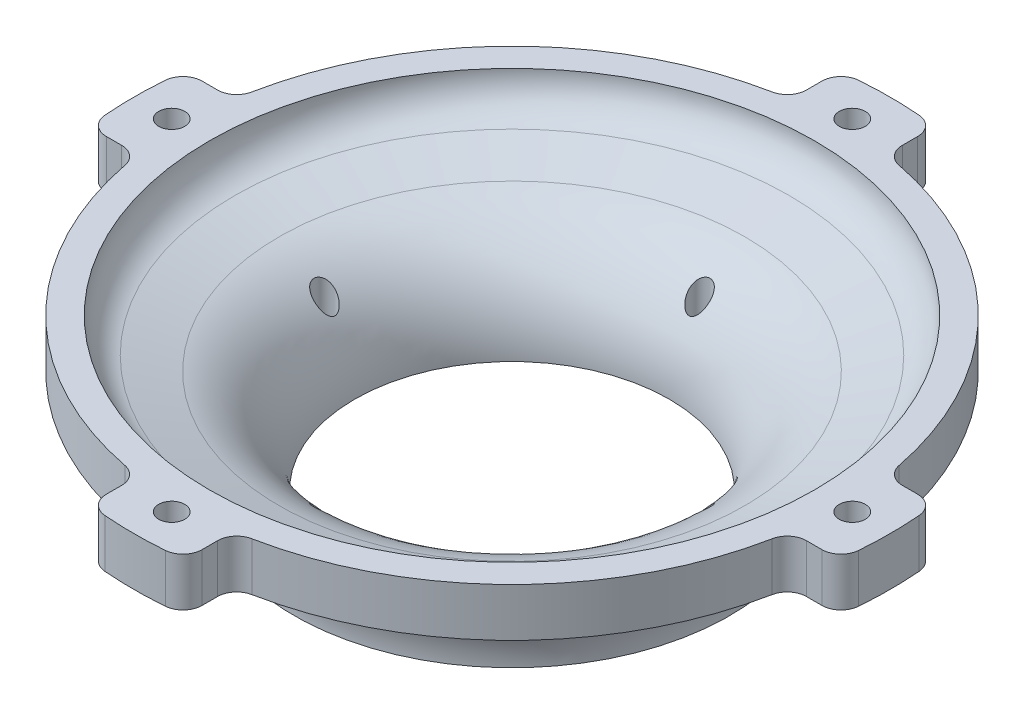
from build123d import *

# Parameters (mm, degrees)
F_18_0_1695_DIAMETER_HOLE1_D = 4.3053
F_8_32_TAPPED_HOLE1_D        = 3.4544
CUT_EXTRUDE1_START           = -28
CUT_EXTRUDE1_DEPTH           = 28


with BuildPart() as part:
    # Sketch1 → Revolve1 (revolve)
    with BuildSketch(Plane.XY, mode=Mode.PRIVATE) as revolve1_sk:
        with BuildLine():
            Line((-62.5, 25), (-62.5, 17))
            Line((-62.5, 17), (-52.5, 17))
            ThreePointArc((-52.5, 17), (-51.542432766, 16.927385203), (-50.606765862, 16.711201572))
            Line((-50.606765862, 16.711201572), (-47.596209994, 15.770845592))
            ThreePointArc((-47.596209994, 15.770845592), (-39.211088387, 9.787640892), (-36, 0))
            Line((-36, 0), (-26, 0))
            ThreePointArc((-26, 0), (-29.461355465, 10.550473923), (-38.5, 17))
            Line((-38.5, 17), (-45.792532285, 19.277843908))
            ThreePointArc((-45.792532285, 19.277843908), (-48.834916691, 21.448737727), (-50, 25))
            Line((-50, 25), (-62.5, 25))
        make_face()
    revolve(revolve1_sk.sketch.rotate(Axis((0, 0, 0), (0, 1, 0)), 270), axis=Axis((0, 0, 0), (0, 1, 0)))

    # #18 (0.1695) Diameter Hole1 (through all)
    with Locations(Plane(origin=(0, 25, 0), x_dir=(1, 0, 0), z_dir=(0, 1, 0))):
        with Locations((0, 56.25), (0, -56.25), (-56.25, 0), (56.25, 0)):
            Hole(F_18_0_1695_DIAMETER_HOLE1_D / 2)

    # #8-32 Tapped Hole1 (through all)
    with Locations(Plane(origin=(0, 0, 0), x_dir=(-1, 0, 0), z_dir=(0, -1, 0))):
        with Locations((0, 31), (0, -31), (-31, 0), (31, 0)):
            Hole(F_8_32_TAPPED_HOLE1_D / 2)

    # Sketch7 → Cut-Extrude1 (cut)
    with BuildSketch(Plane(origin=(0, 44.982495649, 0), x_dir=(1, 0, 0), z_dir=(0, 1, 0)).offset(CUT_EXTRUDE1_START)):
        with BuildLine():
            Line((-56.597564918, 7.921), (-59.13485528, 7.921))
            ThreePointArc((-59.13485528, 7.921), (-61.28824505, 7.07913898), (-62.299678972, 5))
            ThreePointArc((-62.299678972, 5), (-44.194173824, 44.194173824), (-5, 62.299678972))
            ThreePointArc((-5, 62.299678972), (-7.07913898, 61.28824505), (-7.921, 59.13485528))
            Line((-7.921, 59.13485528), (-7.921, 56.597564918))
            ThreePointArc((-7.921, 56.597564918), (-8.644467964, 54.579988714), (-10.485166883, 53.48187801))
            ThreePointArc((-10.485166883, 53.48187801), (-38.537319575, 38.537319575), (-53.48187801, 10.485166883))
            ThreePointArc((-53.48187801, 10.485166883), (-54.579988714, 8.644467964), (-56.597564918, 7.921))
        make_face()
        with BuildLine():
            Line((7.921, 56.597564918), (7.921, 59.13485528))
            ThreePointArc((7.921, 59.13485528), (7.07913898, 61.28824505), (5, 62.299678972))
            ThreePointArc((5, 62.299678972), (44.194173824, 44.194173824), (62.299678972, 5))
            ThreePointArc((62.299678972, 5), (61.28824505, 7.07913898), (59.13485528, 7.921))
            Line((59.13485528, 7.921), (56.597564918, 7.921))
            ThreePointArc((56.597564918, 7.921), (54.579988714, 8.644467964), (53.48187801, 10.485166883))
            ThreePointArc((53.48187801, 10.485166883), (38.537319575, 38.537319575), (10.485166883, 53.48187801))
            ThreePointArc((10.485166883, 53.48187801), (8.644467964, 54.579988714), (7.921, 56.597564918))
        make_face()
        with BuildLine():
            Line((56.597564918, -7.921), (59.13485528, -7.921))
            ThreePointArc((59.13485528, -7.921), (61.28824505, -7.07913898), (62.299678972, -5))
            ThreePointArc((62.299678972, -5), (44.194173824, -44.194173824), (5, -62.299678972))
            ThreePointArc((5, -62.299678972), (7.07913898, -61.28824505), (7.921, -59.13485528))
            Line((7.921, -59.13485528), (7.921, -56.597564918))
            ThreePointArc((7.921, -56.597564918), (8.644467964, -54.579988714), (10.485166883, -53.48187801))
            ThreePointArc((10.485166883, -53.48187801), (38.537319575, -38.537319575), (53.48187801, -10.485166883))
            ThreePointArc((53.48187801, -10.485166883), (54.579988714, -8.644467964), (56.597564918, -7.921))
        make_face()
        with BuildLine():
            Line((-7.921, -56.597564918), (-7.921, -59.13485528))
            ThreePointArc((-7.921, -59.13485528), (-7.07913898, -61.28824505), (-5, -62.299678972))
            ThreePointArc((-5, -62.299678972), (-44.194173824, -44.194173824), (-62.299678972, -5))
            ThreePointArc((-62.299678972, -5), (-61.28824505, -7.07913898), (-59.13485528, -7.921))
            Line((-59.13485528, -7.921), (-56.597564918, -7.921))
            ThreePointArc((-56.597564918, -7.921), (-54.579988714, -8.644467964), (-53.48187801, -10.485166883))
            ThreePointArc((-53.48187801, -10.485166883), (-38.537319575, -38.537319575), (-10.485166883, -53.48187801))
            ThreePointArc((-10.485166883, -53.48187801), (-8.644467964, -54.579988714), (-7.921, -56.597564918))
        make_face()
    extrude(amount=CUT_EXTRUDE1_DEPTH, mode=Mode.SUBTRACT)


solid = part.part
